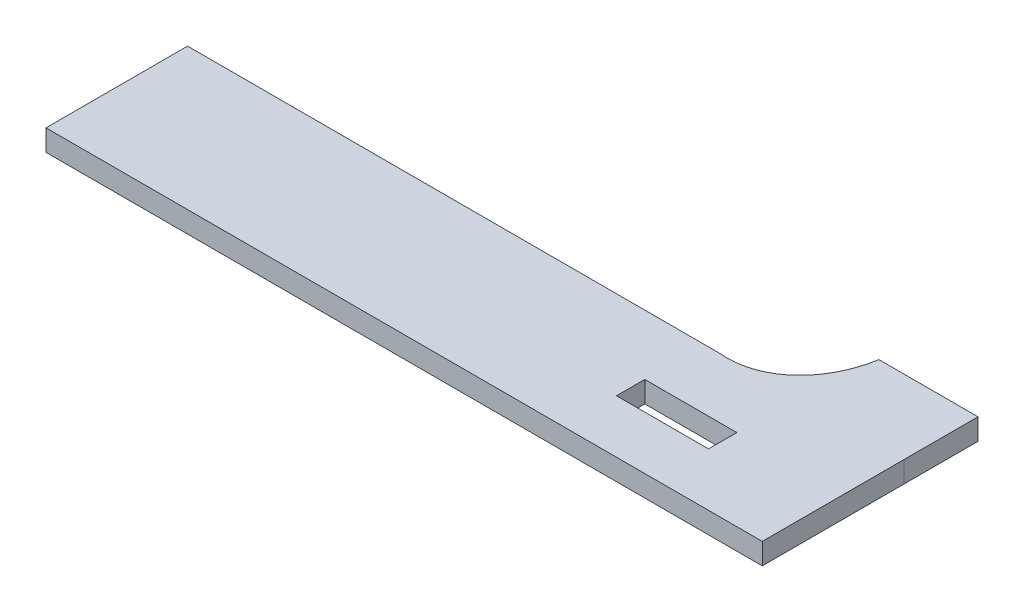
from build123d import *

# Parameters (mm, degrees)
EXTRUDE_1_DEPTH     = 3
SKETCH_4_W          = 13
SKETCH_4_H          = 4
CUT_EXTRUDE_1_DEPTH = 62.023006498


with BuildPart() as part:
    # 草图2 → 凸台-拉伸1 (new body)
    with BuildSketch(Plane(origin=(0, 0, 0), x_dir=(1, 0, 0), z_dir=(0, 1, 0))):
        with BuildLine():
            Line((17.732480436, 10.381771038), (-57.267519564, 10.381771038))
            Line((-57.267519564, 10.381771038), (-57.267519564, -9.618228962))
            Line((-57.267519564, -9.618228962), (43.922480436, -9.618228962))
            Line((43.922480436, -9.618228962), (43.922480436, 10.381771038))
            Line((43.922480436, 10.381771038), (20.060175686, 10.381771038))
            add(Edge.make_bspline(
                [(17.732480436, 10.381771038), (18.54587785, 10.302233399), (19.322070314, 10.305337221), (20.060175686, 10.381771038)],
                knots=[0, 0, 0, 0, 0.115465336, 0.115465336, 0.115465336, 0.115465336], degree=3))
        make_face()
        with BuildLine():
            add(Edge.make_bspline(
                [(20.060175686, 10.381771038), (25.714511546, 10.96730054), (29.13370972, 15.856194464), (29.921192775, 20.862370643)],
                knots=[0.115465336, 0.115465336, 0.115465336, 0.115465336, 1, 1, 1, 1], degree=3))
            Line((20.060175686, 10.381771038), (43.922480436, 10.381771038))
            Line((43.922480436, 10.381771038), (43.921192775, 20.862370643))
            Line((43.921192775, 20.862370643), (29.921192775, 20.862370643))
        make_face()
    extrude(amount=EXTRUDE_1_DEPTH)

    # 草图4 → 切除-拉伸1 (cut, through all)
    with BuildSketch(Plane(origin=(0, 3, 0), x_dir=(1, 0, 0), z_dir=(0, 1, 0))):
        with Locations((22.312601946, -0.100962334)):
            Rectangle(SKETCH_4_W, SKETCH_4_H)
    extrude(amount=-CUT_EXTRUDE_1_DEPTH, mode=Mode.SUBTRACT)


solid = part.part
